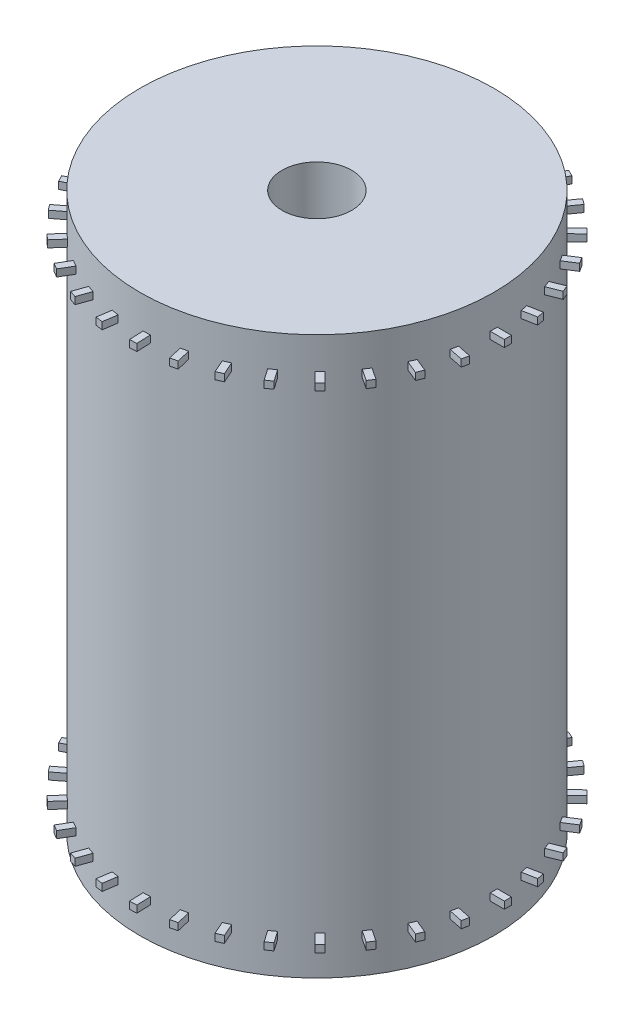
from build123d import *

# Parameters (mm, degrees)
SKETCH1_R                 = 12.7
BOSS_EXTRUDE1_DEPTH       = 40
F_5_0MM_DOWEL_HOLE1_D     = 5
BOSS_EXTRUDE2_START       = -2.794
BOSS_EXTRUDE2_DEPTH       = 0.508
CIRPATTERN3_COUNT         = 33
CIRPATTERN3_ANGLE         = 348.35833943954134
CIRPATTERN3_START         = -2.794
CIRPATTERN3_COPY_1_DEPTH  = 0.508
CIRPATTERN3_COPY_2_DEPTH  = 0.508
CIRPATTERN3_COPY_3_DEPTH  = 0.508
CIRPATTERN3_COPY_4_DEPTH  = 0.508
CIRPATTERN3_COPY_5_DEPTH  = 0.508
CIRPATTERN3_COPY_6_DEPTH  = 0.508
CIRPATTERN3_COPY_7_DEPTH  = 0.508
CIRPATTERN3_COPY_8_DEPTH  = 0.508
CIRPATTERN3_COPY_9_DEPTH  = 0.508
CIRPATTERN3_COPY_10_DEPTH = 0.508
CIRPATTERN3_COPY_11_DEPTH = 0.508
CIRPATTERN3_COPY_12_DEPTH = 0.508
CIRPATTERN3_COPY_13_DEPTH = 0.508
CIRPATTERN3_COPY_14_DEPTH = 0.508
CIRPATTERN3_COPY_15_DEPTH = 0.508
CIRPATTERN3_COPY_16_DEPTH = 0.508
CIRPATTERN3_COPY_17_DEPTH = 0.508
CIRPATTERN3_COPY_18_DEPTH = 0.508
CIRPATTERN3_COPY_19_DEPTH = 0.508
CIRPATTERN3_COPY_20_DEPTH = 0.508
CIRPATTERN3_COPY_21_DEPTH = 0.508
CIRPATTERN3_COPY_22_DEPTH = 0.508
CIRPATTERN3_COPY_23_DEPTH = 0.508
CIRPATTERN3_COPY_24_DEPTH = 0.508
CIRPATTERN3_COPY_25_DEPTH = 0.508
CIRPATTERN3_COPY_26_DEPTH = 0.508
CIRPATTERN3_COPY_27_DEPTH = 0.508
CIRPATTERN3_COPY_28_DEPTH = 0.508
CIRPATTERN3_COPY_29_DEPTH = 0.508
CIRPATTERN3_COPY_30_DEPTH = 0.508
CIRPATTERN3_COPY_31_DEPTH = 0.508
CIRPATTERN3_COPY_32_DEPTH = 0.508


with BuildPart() as part:
    # Sketch1 → Boss-Extrude1 (new body)
    with BuildSketch(Plane(origin=(0, 0, 0), x_dir=(1, 0, 0), z_dir=(0, 1, 0))):
        with Locations(Location((0, 0, 0), (0, 0, 270))):
            Circle(SKETCH1_R)
    extrude(amount=BOSS_EXTRUDE1_DEPTH)

    # Ø5.0mm Dowel Hole1 (through all)
    with Locations(Plane(origin=(0, 40, 0), x_dir=(1, 0, 0), z_dir=(0, 1, 0))):
        with Locations((0, 0)):
            Hole(F_5_0MM_DOWEL_HOLE1_D / 2)

    # Sketch4 → Boss-Extrude2 (add)
    with BuildSketch(Plane(origin=(0, 40, 0), x_dir=(1, 0, 0), z_dir=(0, 1, 0)).offset(BOSS_EXTRUDE2_START)):
        with BuildLine():
            Line((13.713459745949187, 0.254), (12.697459745949187, 0.254))
            ThreePointArc((12.697459745949187, 0.25400000000000006), (12.699364920608327, 0.127006351111512), (12.7, 0))
            ThreePointArc((12.7, -3.11e-15), (12.699364920608327, -0.1270063511115117), (12.697459745949187, -0.25400000000000755))
            Line((12.697459745949187, -0.254), (13.713459745949187, -0.254))
            Line((13.713459745949187, -0.254), (13.713459745949187, 0.254))
        make_face()
    boss_extrude2 = extrude(amount=BOSS_EXTRUDE2_DEPTH)

    # Mirror4: Boss-Extrude2 across plane
    add(boss_extrude2.mirror(Plane.ZX.offset(20)))

    # CirPattern3: Boss-Extrude2 ×33 about axis
    cirpattern3_axis = Axis((-4.2e-16, 0, 3e-17), (0, 1, 0))
    for i in range(1, CIRPATTERN3_COUNT):
        add(boss_extrude2.rotate(cirpattern3_axis, i * CIRPATTERN3_ANGLE / (CIRPATTERN3_COUNT - 1)))

    # CirPattern3 copy 1 sketch → CirPattern3 copy 1 (add)
    with BuildSketch(Plane(origin=(-1e-17, 0, -8e-17), x_dir=(0.9820042351172702, 0, -0.18885889497650102), z_dir=(0, -1, 0)).offset(CIRPATTERN3_START)):
        with BuildLine():
            Line((13.713459745949187, -0.254), (12.697459745949187, -0.254))
            ThreePointArc((12.697459745949187, -0.25400000000000006), (12.699364920608327, -0.127006351111512), (12.7, 0))
            ThreePointArc((12.7, 3.11e-15), (12.699364920608327, 0.1270063511115117), (12.697459745949187, 0.25400000000000755))
            Line((12.697459745949187, 0.254), (13.713459745949187, 0.254))
            Line((13.713459745949187, 0.254), (13.713459745949187, -0.254))
        make_face()
    extrude(amount=CIRPATTERN3_COPY_1_DEPTH)

    # CirPattern3 copy 2 sketch → CirPattern3 copy 2 (add)
    with BuildSketch(Plane(origin=(-4e-17, 0, -1.5e-16), x_dir=(0.9286646355765099, 0, -0.3709204694129835), z_dir=(0, -1, 0)).offset(CIRPATTERN3_START)):
        with BuildLine():
            Line((13.713459745949187, -0.254), (12.697459745949187, -0.254))
            ThreePointArc((12.697459745949187, -0.25400000000000006), (12.699364920608327, -0.127006351111512), (12.7, 0))
            ThreePointArc((12.7, 3.11e-15), (12.699364920608327, 0.1270063511115117), (12.697459745949187, 0.25400000000000755))
            Line((12.697459745949187, 0.254), (13.713459745949187, 0.254))
            Line((13.713459745949187, 0.254), (13.713459745949187, -0.254))
        make_face()
    extrude(amount=CIRPATTERN3_COPY_2_DEPTH)

    # CirPattern3 copy 3 sketch → CirPattern3 copy 3 (add)
    with BuildSketch(Plane(origin=(-8e-17, 0, -2.2e-16), x_dir=(0.841900975162268, 0, -0.5396320487339703), z_dir=(0, -1, 0)).offset(CIRPATTERN3_START)):
        with BuildLine():
            Line((13.713459745949187, -0.254), (12.697459745949187, -0.254))
            ThreePointArc((12.697459745949187, -0.25400000000000006), (12.699364920608327, -0.127006351111512), (12.7, 0))
            ThreePointArc((12.7, 3.11e-15), (12.699364920608327, 0.1270063511115117), (12.697459745949187, 0.25400000000000755))
            Line((12.697459745949187, 0.254), (13.713459745949187, 0.254))
            Line((13.713459745949187, 0.254), (13.713459745949187, -0.254))
        make_face()
    extrude(amount=CIRPATTERN3_COPY_3_DEPTH)

    # CirPattern3 copy 4 sketch → CirPattern3 copy 4 (add)
    with BuildSketch(Plane(origin=(-1.4e-16, 0, -2.8e-16), x_dir=(0.724836010740904, 0, -0.6889214451105526), z_dir=(0, -1, 0)).offset(CIRPATTERN3_START)):
        with BuildLine():
            Line((13.713459745949187, -0.254), (12.697459745949187, -0.254))
            ThreePointArc((12.697459745949187, -0.25400000000000006), (12.699364920608327, -0.127006351111512), (12.7, 0))
            ThreePointArc((12.7, 3.11e-15), (12.699364920608327, 0.1270063511115117), (12.697459745949187, 0.25400000000000755))
            Line((12.697459745949187, 0.254), (13.713459745949187, 0.254))
            Line((13.713459745949187, 0.254), (13.713459745949187, -0.254))
        make_face()
    extrude(amount=CIRPATTERN3_COPY_4_DEPTH)

    # CirPattern3 copy 5 sketch → CirPattern3 copy 5 (add)
    with BuildSketch(Plane(origin=(-2e-16, 0, -3.3e-16), x_dir=(0.5816830894638816, 0, -0.8134155047893751), z_dir=(0, -1, 0)).offset(CIRPATTERN3_START)):
        with BuildLine():
            Line((13.713459745949187, -0.254), (12.697459745949187, -0.254))
            ThreePointArc((12.697459745949187, -0.25400000000000006), (12.699364920608327, -0.127006351111512), (12.7, 0))
            ThreePointArc((12.7, 3.11e-15), (12.699364920608327, 0.1270063511115117), (12.697459745949187, 0.25400000000000755))
            Line((12.697459745949187, 0.254), (13.713459745949187, 0.254))
            Line((13.713459745949187, 0.254), (13.713459745949187, -0.254))
        make_face()
    extrude(amount=CIRPATTERN3_COPY_5_DEPTH)

    # CirPattern3 copy 6 sketch → CirPattern3 copy 6 (add)
    with BuildSketch(Plane(origin=(-2.7e-16, 0, -3.6e-16), x_dir=(0.41759450395835573, 0, -0.9086334961158843), z_dir=(0, -1, 0)).offset(CIRPATTERN3_START)):
        with BuildLine():
            Line((13.713459745949187, -0.254), (12.697459745949187, -0.254))
            ThreePointArc((12.697459745949187, -0.25400000000000006), (12.699364920608327, -0.127006351111512), (12.7, 0))
            ThreePointArc((12.7, 3.11e-15), (12.699364920608327, 0.1270063511115117), (12.697459745949187, 0.25400000000000755))
            Line((12.697459745949187, 0.254), (13.713459745949187, 0.254))
            Line((13.713459745949187, 0.254), (13.713459745949187, -0.254))
        make_face()
    extrude(amount=CIRPATTERN3_COPY_6_DEPTH)

    # CirPattern3 copy 7 sketch → CirPattern3 copy 7 (add)
    with BuildSketch(Plane(origin=(-3.5e-16, 0, -3.8e-16), x_dir=(0.2384760534337201, 0, -0.9711483779210454), z_dir=(0, -1, 0)).offset(CIRPATTERN3_START)):
        with BuildLine():
            Line((13.713459745949187, -0.254), (12.697459745949187, -0.254))
            ThreePointArc((12.697459745949187, -0.25400000000000006), (12.699364920608327, -0.127006351111512), (12.7, 0))
            ThreePointArc((12.7, 3.11e-15), (12.699364920608327, 0.1270063511115117), (12.697459745949187, 0.25400000000000755))
            Line((12.697459745949187, 0.254), (13.713459745949187, 0.254))
            Line((13.713459745949187, 0.254), (13.713459745949187, -0.254))
        make_face()
    extrude(amount=CIRPATTERN3_COPY_7_DEPTH)

    # CirPattern3 copy 8 sketch → CirPattern3 copy 8 (add)
    with BuildSketch(Plane(origin=(-4.3e-16, 0, -3.9e-16), x_dir=(0.05077448493357563, 0, -0.9987101439755832), z_dir=(0, -1, 0)).offset(CIRPATTERN3_START)):
        with BuildLine():
            Line((13.713459745949187, -0.254), (12.697459745949187, -0.254))
            ThreePointArc((12.697459745949187, -0.25400000000000006), (12.699364920608327, -0.127006351111512), (12.7, 0))
            ThreePointArc((12.7, 3.11e-15), (12.699364920608327, 0.1270063511115117), (12.697459745949187, 0.25400000000000755))
            Line((12.697459745949187, 0.254), (13.713459745949187, 0.254))
            Line((13.713459745949187, 0.254), (13.713459745949187, -0.254))
        make_face()
    extrude(amount=CIRPATTERN3_COPY_8_DEPTH)

    # CirPattern3 copy 9 sketch → CirPattern3 copy 9 (add)
    with BuildSketch(Plane(origin=(-5.1e-16, 0, -3.8e-16), x_dir=(-0.13875453495238152, 0, -0.9903268041561575), z_dir=(0, -1, 0)).offset(CIRPATTERN3_START)):
        with BuildLine():
            Line((13.713459745949187, -0.254), (12.697459745949187, -0.254))
            ThreePointArc((12.697459745949187, -0.25400000000000006), (12.699364920608327, -0.127006351111512), (12.7, 0))
            ThreePointArc((12.7, 3.11e-15), (12.699364920608327, 0.1270063511115117), (12.697459745949187, 0.25400000000000755))
            Line((12.697459745949187, 0.254), (13.713459745949187, 0.254))
            Line((13.713459745949187, 0.254), (13.713459745949187, -0.254))
        make_face()
    extrude(amount=CIRPATTERN3_COPY_9_DEPTH)

    # CirPattern3 copy 10 sketch → CirPattern3 copy 10 (add)
    with BuildSketch(Plane(origin=(-5.8e-16, 0, -3.6e-16), x_dir=(-0.32328956686350774, 0, -0.946300087687413), z_dir=(0, -0.9999999999999999, 0)).offset(CIRPATTERN3_START)):
        with BuildLine():
            Line((13.713459745949187, -0.254), (12.697459745949187, -0.254))
            ThreePointArc((12.697459745949187, -0.25400000000000006), (12.699364920608327, -0.127006351111512), (12.7, 0))
            ThreePointArc((12.7, 3.11e-15), (12.699364920608327, 0.1270063511115117), (12.697459745949187, 0.25400000000000755))
            Line((12.697459745949187, 0.254), (13.713459745949187, 0.254))
            Line((13.713459745949187, 0.254), (13.713459745949187, -0.254))
        make_face()
    extrude(amount=CIRPATTERN3_COPY_10_DEPTH)

    # CirPattern3 copy 11 sketch → CirPattern3 copy 11 (add)
    with BuildSketch(Plane(origin=(-6.5e-16, 0, -3.2e-16), x_dir=(-0.4961889127060035, 0, -0.86821458344561), z_dir=(0, -1, 0)).offset(CIRPATTERN3_START)):
        with BuildLine():
            Line((13.713459745949187, -0.254), (12.697459745949187, -0.254))
            ThreePointArc((12.697459745949187, -0.25400000000000006), (12.699364920608327, -0.127006351111512), (12.7, 0))
            ThreePointArc((12.7, 3.11e-15), (12.699364920608327, 0.1270063511115117), (12.697459745949187, 0.25400000000000755))
            Line((12.697459745949187, 0.254), (13.713459745949187, 0.254))
            Line((13.713459745949187, 0.254), (13.713459745949187, -0.254))
        make_face()
    extrude(amount=CIRPATTERN3_COPY_11_DEPTH)

    # CirPattern3 copy 12 sketch → CirPattern3 copy 12 (add)
    with BuildSketch(Plane(origin=(-7.1e-16, 0, -2.7e-16), x_dir=(-0.6512296605275496, 0, -0.7588807081809186), z_dir=(0, -1, 0)).offset(CIRPATTERN3_START)):
        with BuildLine():
            Line((13.713459745949187, -0.254), (12.697459745949187, -0.254))
            ThreePointArc((12.697459745949187, -0.25400000000000006), (12.699364920608327, -0.127006351111512), (12.7, 0))
            ThreePointArc((12.7, 3.11e-15), (12.699364920608327, 0.1270063511115117), (12.697459745949187, 0.25400000000000755))
            Line((12.697459745949187, 0.254), (13.713459745949187, 0.254))
            Line((13.713459745949187, 0.254), (13.713459745949187, -0.254))
        make_face()
    extrude(amount=CIRPATTERN3_COPY_12_DEPTH)

    # CirPattern3 copy 13 sketch → CirPattern3 copy 13 (add)
    with BuildSketch(Plane(origin=(-7.7e-16, 0, -2.1e-16), x_dir=(-0.782831656638069, 0, -0.6222335553193001), z_dir=(0, -1, 0)).offset(CIRPATTERN3_START)):
        with BuildLine():
            Line((13.713459745949187, -0.254), (12.697459745949187, -0.254))
            ThreePointArc((12.697459745949187, -0.25400000000000006), (12.699364920608327, -0.127006351111512), (12.7, 0))
            ThreePointArc((12.7, 3.11e-15), (12.699364920608327, 0.1270063511115117), (12.697459745949187, 0.25400000000000755))
            Line((12.697459745949187, 0.254), (13.713459745949187, 0.254))
            Line((13.713459745949187, 0.254), (13.713459745949187, -0.254))
        make_face()
    extrude(amount=CIRPATTERN3_COPY_13_DEPTH)

    # CirPattern3 copy 14 sketch → CirPattern3 copy 14 (add)
    with BuildSketch(Plane(origin=(-8e-16, 0, -1.4e-16), x_dir=(-0.8862583438773549, 0, -0.46319126493033963), z_dir=(0, -0.9999999999999999, 0)).offset(CIRPATTERN3_START)):
        with BuildLine():
            Line((13.713459745949187, -0.254), (12.697459745949187, -0.254))
            ThreePointArc((12.697459745949187, -0.25400000000000006), (12.699364920608327, -0.127006351111512), (12.7, 0))
            ThreePointArc((12.7, 3.11e-15), (12.699364920608327, 0.1270063511115117), (12.697459745949187, 0.25400000000000755))
            Line((12.697459745949187, 0.254), (13.713459745949187, 0.254))
            Line((13.713459745949187, 0.254), (13.713459745949187, -0.254))
        make_face()
    extrude(amount=CIRPATTERN3_COPY_14_DEPTH)

    # CirPattern3 copy 15 sketch → CirPattern3 copy 15 (add)
    with BuildSketch(Plane(origin=(-8.3e-16, 0, -6e-17), x_dir=(-0.9577872375530923, 0, -0.287478012342538), z_dir=(0, -1, 0)).offset(CIRPATTERN3_START)):
        with BuildLine():
            Line((13.713459745949187, -0.254), (12.697459745949187, -0.254))
            ThreePointArc((12.697459745949187, -0.25400000000000006), (12.699364920608327, -0.127006351111512), (12.7, 0))
            ThreePointArc((12.7, 3.11e-15), (12.699364920608327, 0.1270063511115117), (12.697459745949187, 0.25400000000000755))
            Line((12.697459745949187, 0.254), (13.713459745949187, 0.254))
            Line((13.713459745949187, 0.254), (13.713459745949187, -0.254))
        make_face()
    extrude(amount=CIRPATTERN3_COPY_15_DEPTH)

    # CirPattern3 copy 16 sketch → CirPattern3 copy 16 (add)
    with BuildSketch(Plane(origin=(-8.4e-16, 0, 2e-17), x_dir=(-0.9948439033594602, 0, -0.1014179863165948), z_dir=(0, -0.9999999999999999, 0)).offset(CIRPATTERN3_START)):
        with BuildLine():
            Line((13.713459745949187, -0.254), (12.697459745949187, -0.254))
            ThreePointArc((12.697459745949187, -0.25400000000000006), (12.699364920608327, -0.127006351111512), (12.7, 0))
            ThreePointArc((12.7, 3.11e-15), (12.699364920608327, 0.1270063511115117), (12.697459745949187, 0.25400000000000755))
            Line((12.697459745949187, 0.254), (13.713459745949187, 0.254))
            Line((13.713459745949187, 0.254), (13.713459745949187, -0.254))
        make_face()
    extrude(amount=CIRPATTERN3_COPY_16_DEPTH)

    # CirPattern3 copy 17 sketch → CirPattern3 copy 17 (add)
    with BuildSketch(Plane(origin=(-8.3e-16, 0, 1e-16), x_dir=(-0.9960946152060802, 0, 0.08829222818261512), z_dir=(0, -0.9999999999999999, 0)).offset(CIRPATTERN3_START)):
        with BuildLine():
            Line((13.713459745949187, -0.254), (12.697459745949187, -0.254))
            ThreePointArc((12.697459745949187, -0.25400000000000006), (12.699364920608327, -0.127006351111512), (12.7, 0))
            ThreePointArc((12.7, 3.11e-15), (12.699364920608327, 0.1270063511115117), (12.697459745949187, 0.25400000000000755))
            Line((12.697459745949187, 0.254), (13.713459745949187, 0.254))
            Line((13.713459745949187, 0.254), (13.713459745949187, -0.254))
        make_face()
    extrude(amount=CIRPATTERN3_COPY_17_DEPTH)

    # CirPattern3 copy 18 sketch → CirPattern3 copy 18 (add)
    with BuildSketch(Plane(origin=(-8.1e-16, 0, 1.7e-16), x_dir=(-0.9614943580602967, 0, 0.2748246703231317), z_dir=(0, -0.9999999999999999, 0)).offset(CIRPATTERN3_START)):
        with BuildLine():
            Line((13.713459745949187, -0.254), (12.697459745949187, -0.254))
            ThreePointArc((12.697459745949187, -0.25400000000000006), (12.699364920608327, -0.127006351111512), (12.7, 0))
            ThreePointArc((12.7, 3.11e-15), (12.699364920608327, 0.1270063511115117), (12.697459745949187, 0.25400000000000755))
            Line((12.697459745949187, 0.254), (13.713459745949187, 0.254))
            Line((13.713459745949187, 0.254), (13.713459745949187, -0.254))
        make_face()
    extrude(amount=CIRPATTERN3_COPY_18_DEPTH)

    # CirPattern3 copy 19 sketch → CirPattern3 copy 19 (add)
    with BuildSketch(Plane(origin=(-7.8e-16, 0, 2.5e-16), x_dir=(-0.8922884481070645, 0, 0.4514657521614307), z_dir=(0, -1, 0)).offset(CIRPATTERN3_START)):
        with BuildLine():
            Line((13.713459745949187, -0.254), (12.697459745949187, -0.254))
            ThreePointArc((12.697459745949187, -0.25400000000000006), (12.699364920608327, -0.127006351111512), (12.7, 0))
            ThreePointArc((12.7, 3.11e-15), (12.699364920608327, 0.1270063511115117), (12.697459745949187, 0.25400000000000755))
            Line((12.697459745949187, 0.254), (13.713459745949187, 0.254))
            Line((13.713459745949187, 0.254), (13.713459745949187, -0.254))
        make_face()
    extrude(amount=CIRPATTERN3_COPY_19_DEPTH)

    # CirPattern3 copy 20 sketch → CirPattern3 copy 20 (add)
    with BuildSketch(Plane(origin=(-7.3e-16, 0, 3.1e-16), x_dir=(-0.7909677119144111, 0, 0.6118578909427264), z_dir=(0, -1, 0)).offset(CIRPATTERN3_START)):
        with BuildLine():
            Line((13.713459745949187, -0.254), (12.697459745949187, -0.254))
            ThreePointArc((12.697459745949187, -0.25400000000000006), (12.699364920608327, -0.127006351111512), (12.7, 0))
            ThreePointArc((12.7, 3.11e-15), (12.699364920608327, 0.1270063511115117), (12.697459745949187, 0.25400000000000755))
            Line((12.697459745949187, 0.254), (13.713459745949187, 0.254))
            Line((13.713459745949187, 0.254), (13.713459745949187, -0.254))
        make_face()
    extrude(amount=CIRPATTERN3_COPY_20_DEPTH)

    # CirPattern3 copy 21 sketch → CirPattern3 copy 21 (add)
    with BuildSketch(Plane(origin=(-6.7e-16, 0, 3.6e-16), x_dir=(-0.661178837774873, 0, 0.7502283282299251), z_dir=(0, -1, 0)).offset(CIRPATTERN3_START)):
        with BuildLine():
            Line((13.713459745949187, -0.254), (12.697459745949187, -0.254))
            ThreePointArc((12.697459745949187, -0.25400000000000006), (12.699364920608327, -0.127006351111512), (12.7, 0))
            ThreePointArc((12.7, 3.11e-15), (12.699364920608327, 0.1270063511115117), (12.697459745949187, 0.25400000000000755))
            Line((12.697459745949187, 0.254), (13.713459745949187, 0.254))
            Line((13.713459745949187, 0.254), (13.713459745949187, -0.254))
        make_face()
    extrude(amount=CIRPATTERN3_COPY_21_DEPTH)

    # CirPattern3 copy 22 sketch → CirPattern3 copy 22 (add)
    with BuildSketch(Plane(origin=(-6.1e-16, 0, 4.1e-16), x_dir=(-0.507593125815268, 0, 0.8615969003107459), z_dir=(0, -0.9999999999999999, 0)).offset(CIRPATTERN3_START)):
        with BuildLine():
            Line((13.713459745949187, -0.254), (12.697459745949187, -0.254))
            ThreePointArc((12.697459745949187, -0.25400000000000006), (12.699364920608327, -0.127006351111512), (12.7, 0))
            ThreePointArc((12.7, 3.11e-15), (12.699364920608327, 0.1270063511115117), (12.697459745949187, 0.25400000000000755))
            Line((12.697459745949187, 0.254), (13.713459745949187, 0.254))
            Line((13.713459745949187, 0.254), (13.713459745949187, -0.254))
        make_face()
    extrude(amount=CIRPATTERN3_COPY_22_DEPTH)

    # CirPattern3 copy 23 sketch → CirPattern3 copy 23 (add)
    with BuildSketch(Plane(origin=(-5.3e-16, 0, 4.3e-16), x_dir=(-0.33573836075914154, 0, 0.9419552819082042), z_dir=(0, -1, 0)).offset(CIRPATTERN3_START)):
        with BuildLine():
            Line((13.713459745949187, -0.254), (12.697459745949187, -0.254))
            ThreePointArc((12.697459745949187, -0.25400000000000006), (12.699364920608327, -0.127006351111512), (12.7, 0))
            ThreePointArc((12.7, 3.11e-15), (12.699364920608327, 0.1270063511115117), (12.697459745949187, 0.25400000000000755))
            Line((12.697459745949187, 0.254), (13.713459745949187, 0.254))
            Line((13.713459745949187, 0.254), (13.713459745949187, -0.254))
        make_face()
    extrude(amount=CIRPATTERN3_COPY_23_DEPTH)

    # CirPattern3 copy 24 sketch → CirPattern3 copy 24 (add)
    with BuildSketch(Plane(origin=(-4.5e-16, 0, 4.5e-16), x_dir=(-0.15179985849834504, 0, 0.988411251939132), z_dir=(0, -1, 0)).offset(CIRPATTERN3_START)):
        with BuildLine():
            Line((13.713459745949187, -0.254), (12.697459745949187, -0.254))
            ThreePointArc((12.697459745949187, -0.25400000000000006), (12.699364920608327, -0.127006351111512), (12.7, 0))
            ThreePointArc((12.7, 3.11e-15), (12.699364920608327, 0.1270063511115117), (12.697459745949187, 0.25400000000000755))
            Line((12.697459745949187, 0.254), (13.713459745949187, 0.254))
            Line((13.713459745949187, 0.254), (13.713459745949187, -0.254))
        make_face()
    extrude(amount=CIRPATTERN3_COPY_24_DEPTH)

    # CirPattern3 copy 25 sketch → CirPattern3 copy 25 (add)
    with BuildSketch(Plane(origin=(-3.7e-16, 0, 4.5e-16), x_dir=(0.037602152887987204, 0, 0.9992927889753775), z_dir=(0, -1, 0)).offset(CIRPATTERN3_START)):
        with BuildLine():
            Line((13.713459745949187, -0.254), (12.697459745949187, -0.254))
            ThreePointArc((12.697459745949187, -0.25400000000000006), (12.699364920608327, -0.127006351111512), (12.7, 0))
            ThreePointArc((12.7, 3.11e-15), (12.699364920608327, 0.1270063511115117), (12.697459745949187, 0.25400000000000755))
            Line((12.697459745949187, 0.254), (13.713459745949187, 0.254))
            Line((13.713459745949187, 0.254), (13.713459745949187, -0.254))
        make_face()
    extrude(amount=CIRPATTERN3_COPY_25_DEPTH)

    # CirPattern3 copy 26 sketch → CirPattern3 copy 26 (add)
    with BuildSketch(Plane(origin=(-3e-16, 0, 4.3e-16), x_dir=(0.22565080526940695, 0, 0.9742082498528064), z_dir=(0, -1, 0)).offset(CIRPATTERN3_START)):
        with BuildLine():
            Line((13.713459745949187, -0.254), (12.697459745949187, -0.254))
            ThreePointArc((12.697459745949187, -0.25400000000000006), (12.699364920608327, -0.127006351111512), (12.7, 0))
            ThreePointArc((12.7, 3.11e-15), (12.699364920608327, 0.1270063511115117), (12.697459745949187, 0.25400000000000755))
            Line((12.697459745949187, 0.254), (13.713459745949187, 0.254))
            Line((13.713459745949187, 0.254), (13.713459745949187, -0.254))
        make_face()
    extrude(amount=CIRPATTERN3_COPY_26_DEPTH)

    # CirPattern3 copy 27 sketch → CirPattern3 copy 27 (add)
    with BuildSketch(Plane(origin=(-2.2e-16, 0, 4e-16), x_dir=(0.40557793997637204, 0, 0.9140604655079019), z_dir=(0, -1, 0)).offset(CIRPATTERN3_START)):
        with BuildLine():
            Line((13.713459745949187, -0.254), (12.697459745949187, -0.254))
            ThreePointArc((12.697459745949187, -0.25400000000000006), (12.699364920608327, -0.127006351111512), (12.7, 0))
            ThreePointArc((12.7, 3.11e-15), (12.699364920608327, 0.1270063511115117), (12.697459745949187, 0.25400000000000755))
            Line((12.697459745949187, 0.254), (13.713459745949187, 0.254))
            Line((13.713459745949187, 0.254), (13.713459745949187, -0.254))
        make_face()
    extrude(amount=CIRPATTERN3_COPY_27_DEPTH)

    # CirPattern3 copy 28 sketch → CirPattern3 copy 28 (add)
    with BuildSketch(Plane(origin=(-1.6e-16, 0, 3.6e-16), x_dir=(0.5709077041844638, 0, 0.8210142467112399), z_dir=(0, -1, 0)).offset(CIRPATTERN3_START)):
        with BuildLine():
            Line((13.713459745949187, -0.254), (12.697459745949187, -0.254))
            ThreePointArc((12.697459745949187, -0.25400000000000006), (12.699364920608327, -0.127006351111512), (12.7, 0))
            ThreePointArc((12.7, 3.11e-15), (12.699364920608327, 0.1270063511115117), (12.697459745949187, 0.25400000000000755))
            Line((12.697459745949187, 0.254), (13.713459745949187, 0.254))
            Line((13.713459745949187, 0.254), (13.713459745949187, -0.254))
        make_face()
    extrude(amount=CIRPATTERN3_COPY_28_DEPTH)

    # CirPattern3 copy 29 sketch → CirPattern3 copy 29 (add)
    with BuildSketch(Plane(origin=(-1e-16, 0, 3e-16), x_dir=(0.7156896267640703, 0, 0.6984184692162041), z_dir=(0, -1, 0)).offset(CIRPATTERN3_START)):
        with BuildLine():
            Line((13.713459745949187, -0.254), (12.697459745949187, -0.254))
            ThreePointArc((12.697459745949187, -0.25400000000000006), (12.699364920608327, -0.127006351111512), (12.7, 0))
            ThreePointArc((12.7, 3.11e-15), (12.699364920608327, 0.1270063511115117), (12.697459745949187, 0.25400000000000755))
            Line((12.697459745949187, 0.254), (13.713459745949187, 0.254))
            Line((13.713459745949187, 0.254), (13.713459745949187, -0.254))
        make_face()
    extrude(amount=CIRPATTERN3_COPY_29_DEPTH)

    # CirPattern3 copy 30 sketch → CirPattern3 copy 30 (add)
    with BuildSketch(Plane(origin=(-5e-17, 0, 2.4e-16), x_dir=(0.8347127848391671, 0, 0.5506855425976265), z_dir=(0, -1, 0)).offset(CIRPATTERN3_START)):
        with BuildLine():
            Line((13.713459745949187, -0.254), (12.697459745949187, -0.254))
            ThreePointArc((12.697459745949187, -0.25400000000000006), (12.699364920608327, -0.127006351111512), (12.7, 0))
            ThreePointArc((12.7, 3.11e-15), (12.699364920608327, 0.1270063511115117), (12.697459745949187, 0.25400000000000755))
            Line((12.697459745949187, 0.254), (13.713459745949187, 0.254))
            Line((13.713459745949187, 0.254), (13.713459745949187, -0.254))
        make_face()
    extrude(amount=CIRPATTERN3_COPY_30_DEPTH)

    # CirPattern3 copy 31 sketch → CirPattern3 copy 31 (add)
    with BuildSketch(Plane(origin=(-2e-17, 0, 1.6e-16), x_dir=(0.9236933528731155, 0, 0.38313260088123824), z_dir=(0, -1, 0)).offset(CIRPATTERN3_START)):
        with BuildLine():
            Line((13.713459745949187, -0.254), (12.697459745949187, -0.254))
            ThreePointArc((12.697459745949187, -0.25400000000000006), (12.699364920608327, -0.127006351111512), (12.7, 0))
            ThreePointArc((12.7, 3.11e-15), (12.699364920608327, 0.1270063511115117), (12.697459745949187, 0.25400000000000755))
            Line((12.697459745949187, 0.254), (13.713459745949187, 0.254))
            Line((13.713459745949187, 0.254), (13.713459745949187, -0.254))
        make_face()
    extrude(amount=CIRPATTERN3_COPY_31_DEPTH)

    # CirPattern3 copy 32 sketch → CirPattern3 copy 32 (add)
    with BuildSketch(Plane(origin=(0, 0, 9e-17), x_dir=(0.979428784102974, 0, 0.201790130756115), z_dir=(0, -1, 0)).offset(CIRPATTERN3_START)):
        with BuildLine():
            Line((13.713459745949187, -0.254), (12.697459745949187, -0.254))
            ThreePointArc((12.697459745949187, -0.25400000000000006), (12.699364920608327, -0.127006351111512), (12.7, 0))
            ThreePointArc((12.7, 3.11e-15), (12.699364920608327, 0.1270063511115117), (12.697459745949187, 0.25400000000000755))
            Line((12.697459745949187, 0.254), (13.713459745949187, 0.254))
            Line((13.713459745949187, 0.254), (13.713459745949187, -0.254))
        make_face()
    extrude(amount=CIRPATTERN3_COPY_32_DEPTH)


solid = part.part
